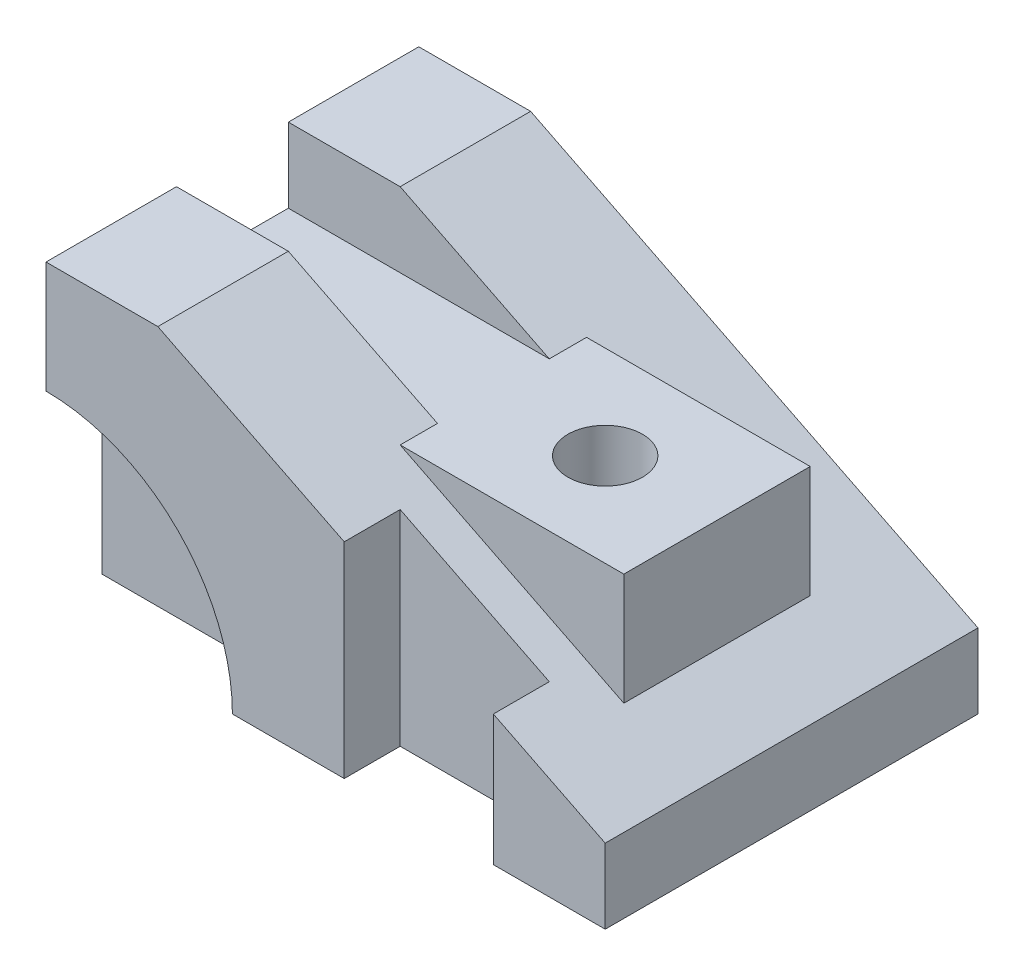
from build123d import *

# Parameters (mm, degrees)
BOSS_EXTRUDE1_DEPTH      = 50
BOSS_EXTRUDE1_DEPTH_BACK = 50
SKETCH2_R                = 50
CUT_EXTRUDE1_DEPTH       = 15
BOSS_EXTRUDE2_DEPTH      = 25
BOSS_EXTRUDE2_DEPTH_BACK = 25
SKETCH6_W                = 134.888927635
SKETCH6_H                = 30
CUT_EXTRUDE2_DEPTH       = 170.115345253
SKETCH7_R                = 10
CUT_EXTRUDE3_DEPTH       = 170.115345253
SKETCH8_W                = 40
SKETCH8_H                = 15
CUT_EXTRUDE4_DEPTH       = 178.200451467


with BuildPart() as part:
    # Sketch1 → Boss-Extrude1 (new, two sides: drawn at the far end of the back side and taken through both)
    with BuildSketch(Plane.XY.offset(-BOSS_EXTRUDE1_DEPTH_BACK)):
        Polygon((0, 0), (150, 0), (150, 20), (30, 80), (0, 80), align=None)
    extrude(amount=BOSS_EXTRUDE1_DEPTH + BOSS_EXTRUDE1_DEPTH_BACK)

    # Sketch2 → Cut-Extrude1 (cut)
    with BuildSketch(Plane.XY.offset(50)):
        Circle(SKETCH2_R)
    extrude(amount=-CUT_EXTRUDE1_DEPTH, mode=Mode.SUBTRACT)

    # Sketch5 → Boss-Extrude2 (add, two sides: drawn at the far end of the back side and taken through both)
    with BuildSketch(Plane.XY.offset(-BOSS_EXTRUDE2_DEPTH_BACK)):
        Polygon((70, 60), (130, 60), (130, 30), align=None)
    extrude(amount=BOSS_EXTRUDE2_DEPTH + BOSS_EXTRUDE2_DEPTH_BACK)

    # Sketch6 → Cut-Extrude2 (cut, through all)
    with BuildSketch(Plane(origin=(0, 60, 0), x_dir=(1, 0, 0), z_dir=(0, 1, 0))):
        with Locations((48.967296131, 0)):
            Rectangle(SKETCH6_W, SKETCH6_H)
    extrude(amount=CUT_EXTRUDE2_DEPTH, mode=Mode.SUBTRACT)

    # Sketch7 → Cut-Extrude3 (cut, through all)
    with BuildSketch(Plane(origin=(0, 60, 0), x_dir=(1, 0, 0), z_dir=(0, 1, 0))):
        with Locations((100, 0)):
            Circle(SKETCH7_R)
    extrude(amount=-CUT_EXTRUDE3_DEPTH, mode=Mode.SUBTRACT)

    # Sketch8 → Cut-Extrude4 (cut, through all)
    with BuildSketch(Plane.XZ):
        with Locations((100, 42.5)):
            Rectangle(SKETCH8_W, SKETCH8_H)
    extrude(amount=-CUT_EXTRUDE4_DEPTH, mode=Mode.SUBTRACT)


solid = part.part
